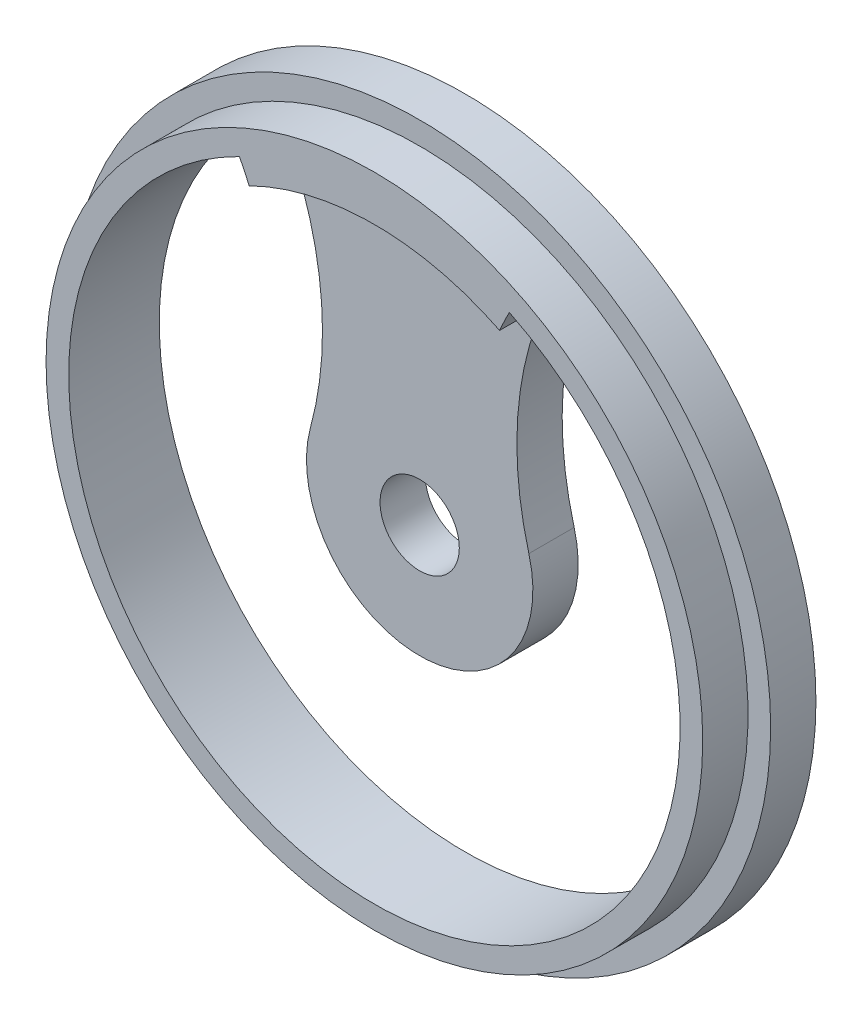
from build123d import *

# Parameters (mm, degrees)
SKETCH1_R           = 14.5
BOSS_EXTRUDE1_DEPTH = 2
SKETCH2_R           = 14.5
SKETCH2_R_2         = 12.5
BOSS_EXTRUDE2_DEPTH = 2
SKETCH3_R           = 1.75
CUT_EXTRUDE1_DEPTH  = 2
SKETCH4_R           = 15.5
SKETCH4_R_2         = 14.5
BOSS_EXTRUDE3_DEPTH = 2
CUT_EXTRUDE2_DEPTH  = 23.282279955


with BuildPart() as part:
    # Sketch1 → Boss-Extrude1 (new body)
    with BuildSketch(Plane.XY):
        Circle(SKETCH1_R)
    extrude(amount=BOSS_EXTRUDE1_DEPTH)

    # Sketch2 → Boss-Extrude2 (add)
    with BuildSketch(Plane.XY.offset(2)):
        Circle(SKETCH2_R)
        Circle(SKETCH2_R_2, mode=Mode.SUBTRACT)
    extrude(amount=BOSS_EXTRUDE2_DEPTH)

    # Sketch3 → Cut-Extrude1 (cut)
    with BuildSketch(Plane.XY.offset(2)):
        Circle(SKETCH3_R)
    extrude(amount=-CUT_EXTRUDE1_DEPTH, mode=Mode.SUBTRACT)

    # Sketch4 → Boss-Extrude3 (add)
    with BuildSketch(Plane(origin=(0, 0, 0), x_dir=(-1, 0, 0), z_dir=(0, 0, -1))):
        Circle(SKETCH4_R)
        Circle(SKETCH4_R_2, mode=Mode.SUBTRACT)
    extrude(amount=-BOSS_EXTRUDE3_DEPTH)

    # Sketch5 → Cut-Extrude2 (cut, through all)
    with BuildSketch(Plane(origin=(0, 0, 0), x_dir=(-1, 0, 0), z_dir=(0, 0, -1))):
        with BuildLine():
            ThreePointArc((-4.822296171, 1.321158447), (0, -5), (4.822296171, 1.321158447))
            ThreePointArc((4.822296171, 1.321158447), (4.3745284, 6.824326541), (5.960008585, 12.113145655))
            ThreePointArc((5.960008585, 12.113145655), (0, -13.5), (-5.960008585, 12.113145655))
            ThreePointArc((-5.960008585, 12.113145655), (-4.3745284, 6.824326541), (-4.822296171, 1.321158447))
        make_face()
    extrude(amount=-CUT_EXTRUDE2_DEPTH, mode=Mode.SUBTRACT)


solid = part.part
